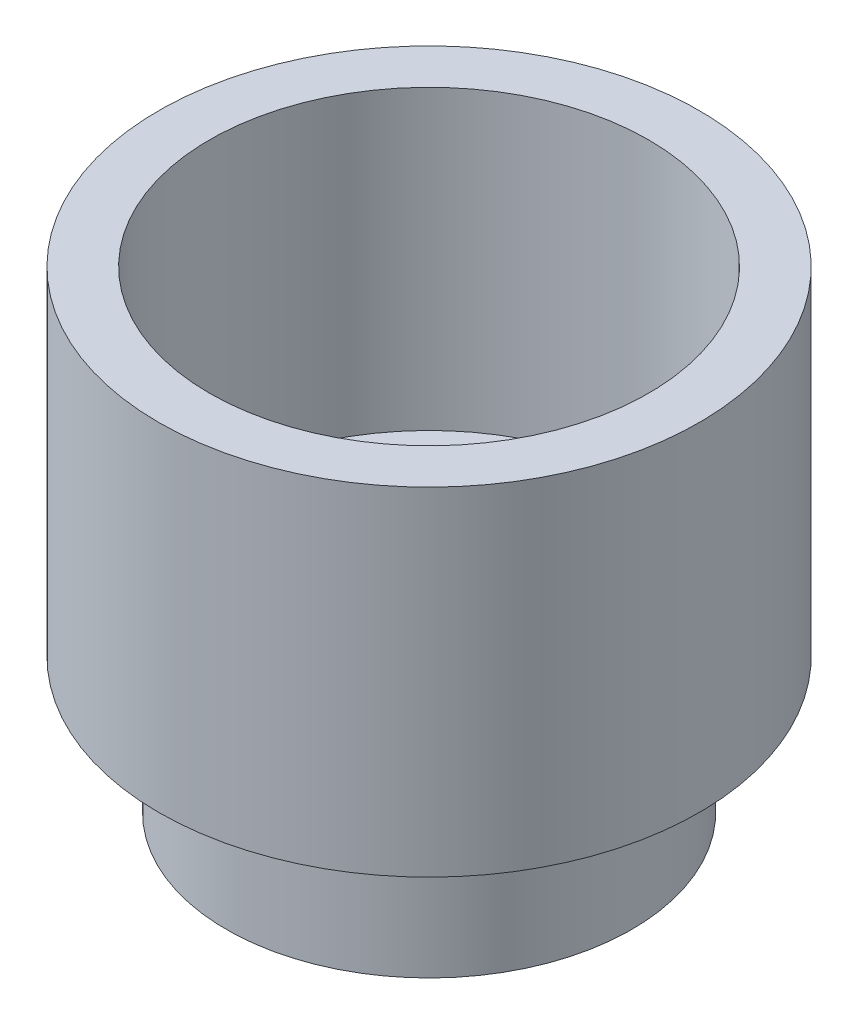
from build123d import *

# Parameters (mm, degrees)
SKETCH1_R           = 5.08
BOSS_EXTRUDE1_DEPTH = 6.35
SKETCH2_R           = 4.1275
CUT_EXTRUDE1_DEPTH  = 5.588
SKETCH3_R           = 3.81
BOSS_EXTRUDE2_DEPTH = 2.54
SKETCH4_R           = 2.54
CUT_EXTRUDE2_DEPTH  = 2.54


with BuildPart() as part:
    # Sketch1 → Boss-Extrude1 (new body)
    with BuildSketch(Plane(origin=(0, 0, 0), x_dir=(1, 0, 0), z_dir=(0, 1, 0))):
        with Locations(Location((0, 0, 0), (0, 0, 270))):
            Circle(SKETCH1_R)
    extrude(amount=BOSS_EXTRUDE1_DEPTH)

    # Sketch2 → Cut-Extrude1 (cut)
    with BuildSketch(Plane(origin=(0, 6.35, 0), x_dir=(1, 0, 0), z_dir=(0, 1, 0))):
        with Locations(Location((0, 0, 0), (0, 0, 270))):
            Circle(SKETCH2_R)
    extrude(amount=-CUT_EXTRUDE1_DEPTH, mode=Mode.SUBTRACT)

    # Sketch3 → Boss-Extrude2 (add)
    with BuildSketch(Plane.XZ):
        with Locations(Location((0, 0, 0), (0, 0, 270))):
            Circle(SKETCH3_R)
    extrude(amount=BOSS_EXTRUDE2_DEPTH)

    # Sketch4 → Cut-Extrude2 (cut)
    with BuildSketch(Plane.XZ.offset(2.54)):
        with Locations(Location((0, 0, 0), (0, 0, 270))):
            Circle(SKETCH4_R)
    extrude(amount=-CUT_EXTRUDE2_DEPTH, mode=Mode.SUBTRACT)


solid = part.part
